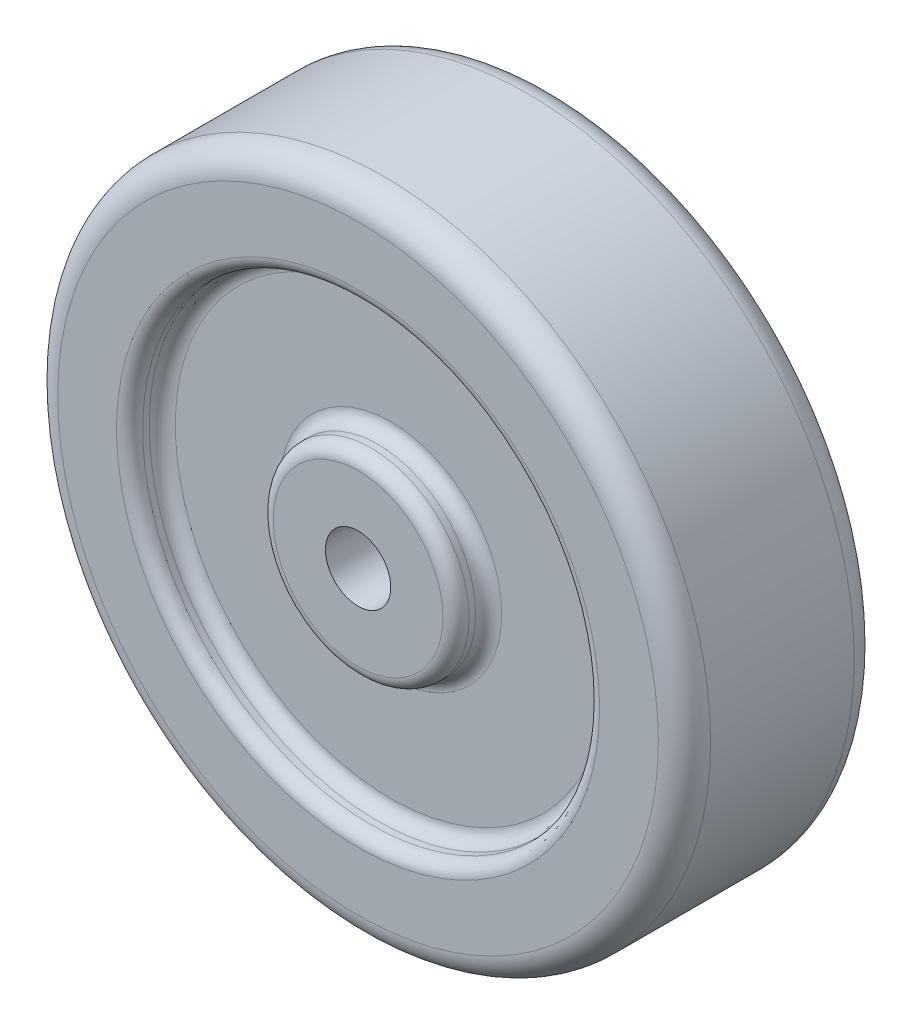
from build123d import *

# Parameters (mm, degrees)
SKETCH1_R           = 31.75
BOSS_EXTRUDE1_DEPTH = 9.525
FILLET1_R           = 2.54
SKETCH2_R           = 22.225
SKETCH2_R_2         = 9.525
CUT_EXTRUDE1_DEPTH  = 3.175
FILLET2_R           = 1.27
SKETCH3_R           = 3.175
CUT_EXTRUDE2_DEPTH  = 49.775275564


with BuildPart() as part:
    # Sketch1 → Boss-Extrude1 (new body)
    with BuildSketch(Plane.XY):
        with Locations(Location((0, 0, 0), (0, 0, 180))):
            Circle(SKETCH1_R)
    extrude(amount=BOSS_EXTRUDE1_DEPTH)

    # Fillet1
    fillet1_edges = [part.edges().sort_by_distance(p)[0] for p in [
        (31.75, 0, 9.525),
    ]]
    fillet(fillet1_edges, radius=FILLET1_R)

    # Sketch2 → Cut-Extrude1 (cut)
    with BuildSketch(Plane.XY.offset(9.525)):
        Circle(SKETCH2_R)
        Circle(SKETCH2_R_2, mode=Mode.SUBTRACT)
    extrude(amount=-CUT_EXTRUDE1_DEPTH, mode=Mode.SUBTRACT)

    # Fillet2
    fillet2_edges = [part.edges().sort_by_distance(p)[0] for p in [
        (-9.525, 0, 6.35),
        (-22.225, 0, 9.525),
        (-9.525, 0, 9.525),
        (-22.225, 0, 6.35),
    ]]
    fillet(fillet2_edges, radius=FILLET2_R)

    # Mirror8: part across plane


with BuildPart() as part_1:
    add(part.part)
    add(part.part.mirror(Plane.XY))

    # Sketch3 → Cut-Extrude2 (cut, through all)
    with BuildSketch(Plane.XY.offset(9.525)):
        Circle(SKETCH3_R)
    extrude(amount=-CUT_EXTRUDE2_DEPTH, mode=Mode.SUBTRACT)


solid = part_1.part
